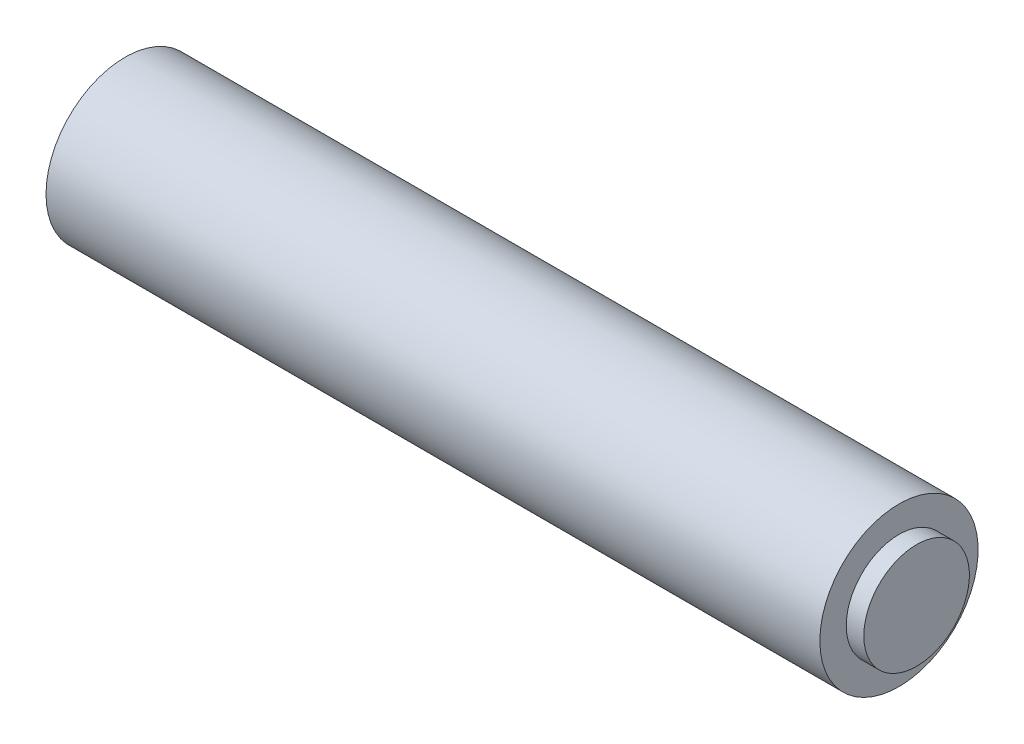
from build123d import *


with BuildPart() as part:
    # Schizzo3 → Rivoluzione1 (revolve)
    with BuildSketch(Plane.XY, mode=Mode.PRIVATE) as rivoluzione1_sk:
        Polygon((-35.546164343, 0), (-35.546164343, 3), (-34.546164343, 3), (-34.546164343, 4.5), (9.453835657, 4.5), (9.453835657, 3), (10.453835657, 3), (10.453835657, 0), align=None)
    revolve(rivoluzione1_sk.sketch.rotate(Axis((-60.965401978, 0, 0), (1, 0, 0)), 90), axis=Axis((-60.965401978, 0, 0), (1, 0, 0)))


solid = part.part
